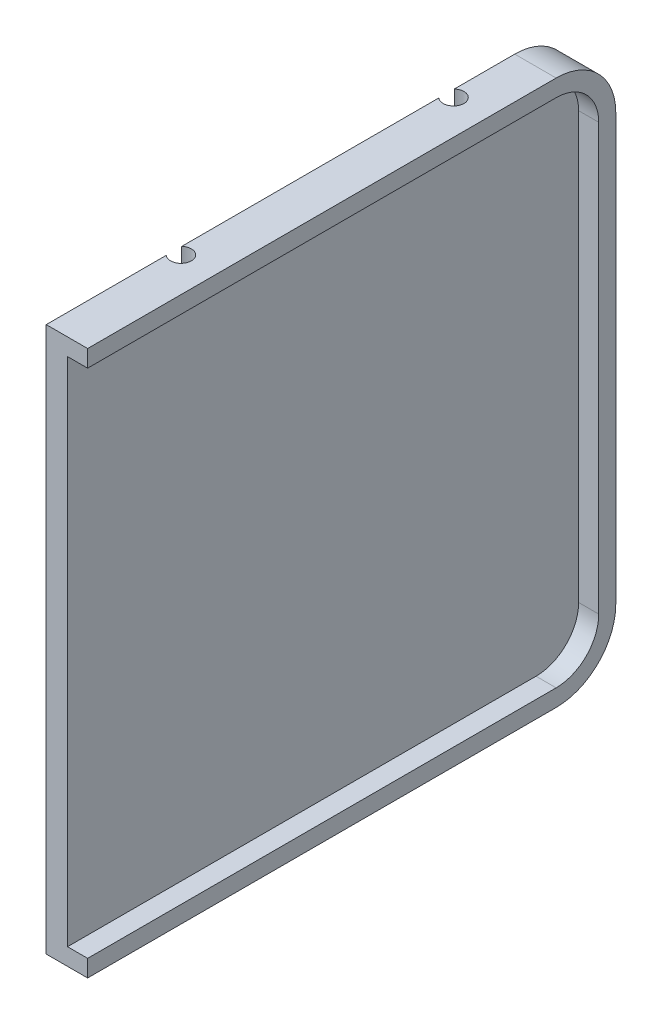
from build123d import *

# Parameters (mm, degrees)
BOSS_EXTRUDE1_DEPTH = 3.175
EXTRUDE_THIN1_START = -6.1722
EXTRUDE_THIN1_DEPTH = 6.1722
SKETCH5_R           = 1.475
BOSS_EXTRUDE2_DEPTH = 5
SKETCH6_R           = 1.55
CUT_EXTRUDE1_DEPTH  = 213.890793601
CHAMFER1_SIZE       = 0.508
SKETCH7_R           = 2.5
BOSS_EXTRUDE3_DEPTH = 0.254


with BuildPart() as part:
    # Sketch1 → Boss-Extrude1 (new body)
    with BuildSketch(Plane.ZY.offset(-35.1028)):
        with BuildLine():
            Line((-114.3, 38.1), (-114.3, -38.1))
            Line((-114.3, -38.1), (-184.15, -38.1))
            ThreePointArc((-184.15, -38.1), (-188.640128061, -36.240128061), (-190.5, -31.75))
            Line((-190.5, -31.75), (-190.5, 31.75))
            ThreePointArc((-190.5, 31.75), (-188.640128061, 36.240128061), (-184.15, 38.1))
            Line((-184.15, 38.1), (-114.3, 38.1))
        make_face()
    extrude(amount=BOSS_EXTRUDE1_DEPTH)

    # Sketch4 → Extrude-Thin1 (add)
    with BuildSketch(Plane.ZY.offset(-31.9278).offset(EXTRUDE_THIN1_START)):
        with BuildLine():
            Line((-114.3, 38.1), (-184.15, 38.1))
            ThreePointArc((-184.15, 38.1), (-188.640128061, 36.240128061), (-190.5, 31.75))
            Line((-190.5, 31.75), (-190.5, -31.75))
            ThreePointArc((-190.5, -31.75), (-188.640128061, -36.240128061), (-184.15, -38.1))
            Line((-184.15, -38.1), (-114.3, -38.1))
            Line((-114.3, -38.1), (-114.3, -40.64))
            Line((-114.3, -40.64), (-184.15, -40.64))
            ThreePointArc((-184.15, -40.64), (-190.436179285, -38.036179285), (-193.04, -31.75))
            Line((-193.04, -31.75), (-193.04, 31.75))
            ThreePointArc((-193.04, 31.75), (-190.436179285, 38.036179285), (-184.15, 40.64))
            Line((-184.15, 40.64), (-114.3, 40.64))
            Line((-114.3, 40.64), (-114.3, 38.1))
        make_face()
    extrude(amount=EXTRUDE_THIN1_DEPTH)

    # Sketch5 → Boss-Extrude2 (add)
    with BuildSketch(Plane.ZY.offset(-31.9278)):
        with Locations(Location((-186.69, 33.075, 0), (0, 0, 180))):
            Circle(SKETCH5_R)
        with Locations(Location((-120.65, 33.075, 0), (0, 0, 180))):
            Circle(SKETCH5_R)
        with Locations(Location((-120.65, -33.075, 0), (0, 0, 180))):
            Circle(SKETCH5_R)
        with Locations(Location((-186.69, -33.075, 0), (0, 0, 180))):
            Circle(SKETCH5_R)
    extrude(amount=BOSS_EXTRUDE2_DEPTH)

    # Sketch6 → Cut-Extrude1 (cut, through all)
    with BuildSketch(Plane(origin=(0, 40.64, 0), x_dir=(1, 0, 0), z_dir=(0, 1, 0))):
        with Locations((32.9698, 173.99)):
            Circle(SKETCH6_R)
        with Locations((32.9698, 133.35)):
            Circle(SKETCH6_R)
    extrude(amount=-CUT_EXTRUDE1_DEPTH, mode=Mode.SUBTRACT)

    # Chamfer1
    chamfer1_edges = [part.edges().sort_by_distance(p)[0] for p in [
        (26.9278, -33.075, -185.215),
        (26.9278, -33.075, -119.175),
        (26.9278, 33.075, -119.175),
        (26.9278, 33.075, -185.215),
    ]]
    chamfer(chamfer1_edges, length=CHAMFER1_SIZE)

    # Sketch7 → Boss-Extrude3 (add)
    with BuildSketch(Plane.ZY.offset(-31.9278)):
        with Locations(Location((-186.69, 33.075, 0), (0, 0, 180))):
            Circle(SKETCH7_R)
        with Locations(Location((-120.65, 33.075, 0), (0, 0, 180))):
            Circle(SKETCH7_R)
        with Locations(Location((-120.65, -33.075, 0), (0, 0, 180))):
            Circle(SKETCH7_R)
        with Locations(Location((-186.69, -33.075, 0), (0, 0, 180))):
            Circle(SKETCH7_R)
    extrude(amount=BOSS_EXTRUDE3_DEPTH)


solid = part.part
